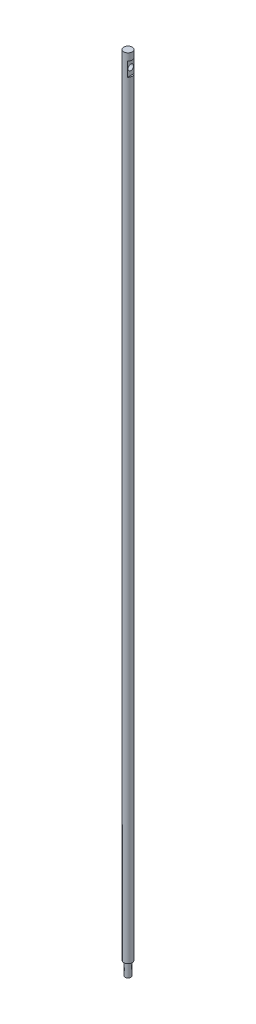
from build123d import *

# Parameters (mm, degrees)
SKETCH_2_R          = 3
EXTRUDE_1_DEPTH     = 540
SKETCH_3_R          = 2
EXTRUDE_2_DEPTH     = 9.5
SKETCH_4_R          = 3
EXTRUDE_3_DEPTH     = 20
SKETCH_6_W          = 1
SKETCH_6_H          = 10
CUT_EXTRUDE_2_DEPTH = 5
SKETCH_7_R          = 2
CUT_EXTRUDE_3_DEPTH = 10


with BuildPart() as part:
    # 草图2 → 凸台-拉伸1 (new body)
    with BuildSketch(Plane(origin=(0, 0, 0), x_dir=(1, 0, 0), z_dir=(0, 1, 0))):
        with Locations(Location((0, 0, 0), (0, 0, 270))):
            Circle(SKETCH_2_R)
    extrude(amount=EXTRUDE_1_DEPTH)

    # 草图3 → 凸台-拉伸2 (add)
    with BuildSketch(Plane.XZ):
        with Locations(Location((0, 0, 0), (0, 0, 90))):
            Circle(SKETCH_3_R)
    extrude(amount=EXTRUDE_2_DEPTH)

    # 草图4 → 凸台-拉伸3 (add)
    with BuildSketch(Plane(origin=(0, 540, 0), x_dir=(1, 0, 0), z_dir=(0, 1, 0))):
        with Locations(Location((0, 0, 0), (0, 0, 270))):
            Circle(SKETCH_4_R)
    extrude(amount=EXTRUDE_3_DEPTH)

    # 草图6 → 切除-拉伸2 (cut, symmetric)
    with BuildSketch(Plane.XY):
        with Locations((-2.5, 550)):
            Rectangle(SKETCH_6_W, SKETCH_6_H)
        with Locations((2.5, 550)):
            Rectangle(SKETCH_6_W, SKETCH_6_H)
    extrude(amount=CUT_EXTRUDE_2_DEPTH, both=True, mode=Mode.SUBTRACT)

    # 草图7 → 切除-拉伸3 (cut)
    with BuildSketch(Plane.ZY.offset(2)):
        with Locations((0, 550)):
            Circle(SKETCH_7_R)
    extrude(amount=-CUT_EXTRUDE_3_DEPTH, mode=Mode.SUBTRACT)


solid = part.part
